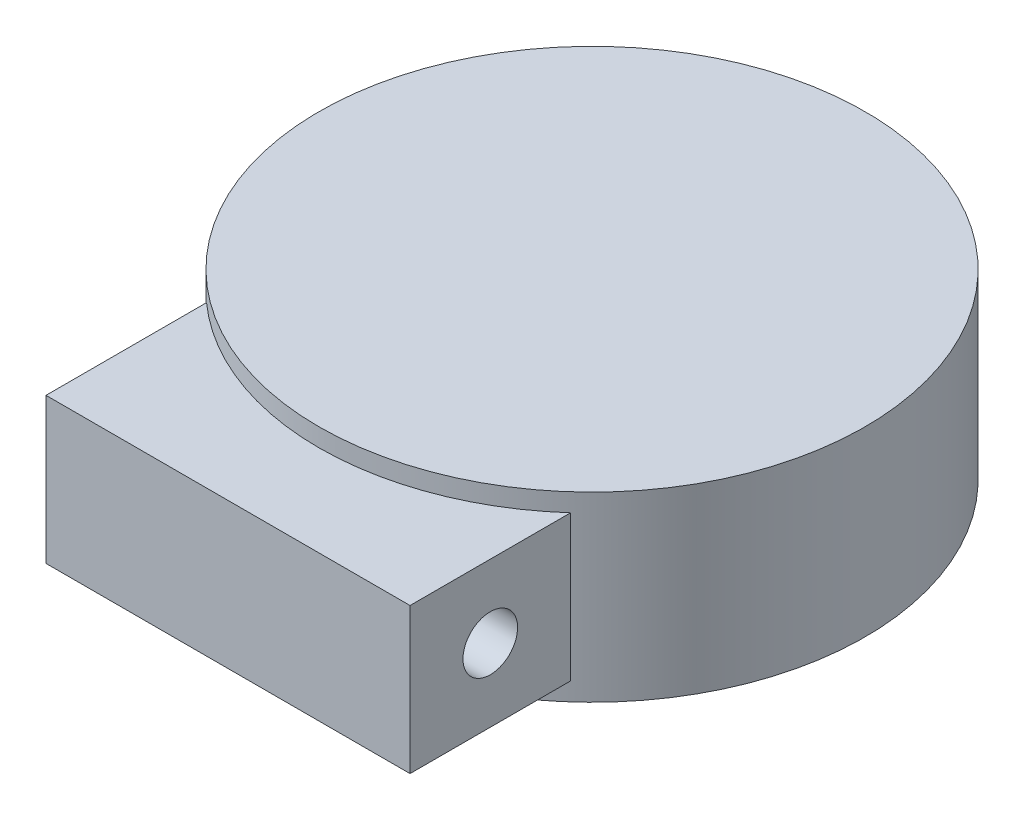
from build123d import *

# Parameters (mm, degrees)
SKETCH1_R           = 38.1
BOSS_EXTRUDE1_DEPTH = 25.4
SKETCH2_W           = 50.8
SKETCH2_H           = 20.32
BOSS_EXTRUDE2_DEPTH = 50.8
CUT_EXTRUDE1_REACH  = 87.194
SKETCH3_R           = 3.81


with BuildPart() as part:
    # Sketch1 → Boss-Extrude1 (new body)
    with BuildSketch(Plane(origin=(0, 0, 0), x_dir=(1, 0, 0), z_dir=(0, 1, 0))):
        with Locations(Location((0, 0, 0), (0, 0, 270))):
            Circle(SKETCH1_R)
    extrude(amount=BOSS_EXTRUDE1_DEPTH)

    # Sketch2 → Boss-Extrude2 (add)
    with BuildSketch(Plane.XY):
        with Locations((0, 12.7)):
            Rectangle(SKETCH2_W, SKETCH2_H)
    extrude(amount=BOSS_EXTRUDE2_DEPTH)

    # Sketch3 → Cut-Extrude1 (cut, up to next)
    with BuildSketch(Plane.ZY.offset(25.4), mode=Mode.PRIVATE) as cut_extrude1_sk1:
        with Locations(Location((39.599031657, 12.7, 0), (0, 0, 270))):
            Circle(SKETCH3_R)
    cut_extrude1_tool1 = extrude(cut_extrude1_sk1.sketch, amount=-CUT_EXTRUDE1_REACH, mode=Mode.PRIVATE) & part.part
    add(cut_extrude1_tool1.solids().sort_by_distance((-25.4, 12.7, 39.599032))[0], mode=Mode.SUBTRACT)


solid = part.part
